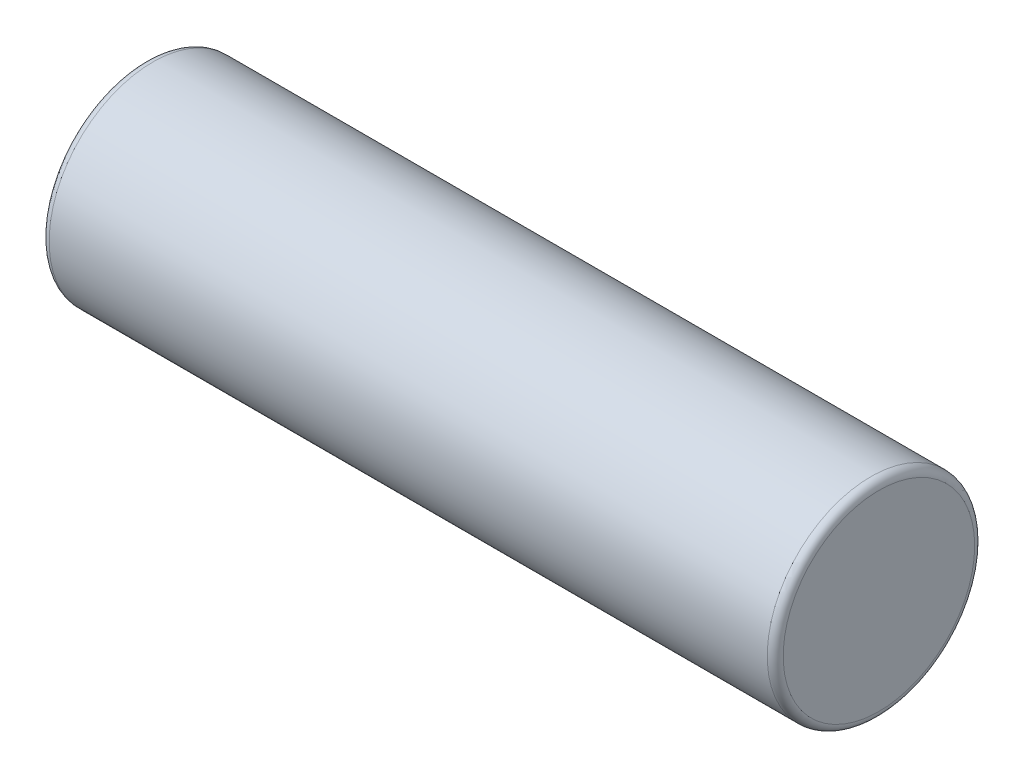
from build123d import *

# Parameters (mm, degrees)
SKETCH_3_R      = 6.5
EXTRUDE_1_DEPTH = 46
FILLET_1_R      = 0.5


with BuildPart() as part:
    # Эскиз3 → Бобышка-Вытянуть1 (new body)
    with BuildSketch(Plane(origin=(0, 0, 0), x_dir=(0, 0, -1), z_dir=(1, 0, 0))):
        Circle(SKETCH_3_R)
    extrude(amount=EXTRUDE_1_DEPTH)

    # Скругление1
    fillet_1_edges = [part.edges().sort_by_distance(p)[0] for p in [
        (0, 0, 6.5),
        (46, 0, 6.5),
    ]]
    fillet(fillet_1_edges, radius=FILLET_1_R)


solid = part.part
